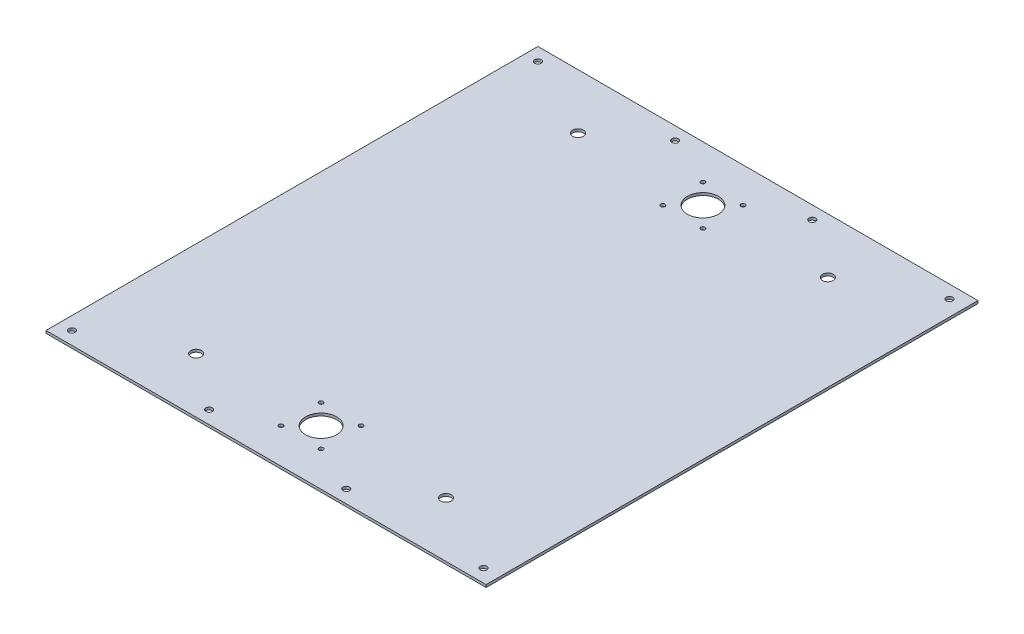
from build123d import *

# Parameters (mm, degrees)
SKICA1_W                 = 340
SKICA1_H                 = 380
SKICA1_R                 = 2.5
P_IDAT_VYSUNUT_M1_DEPTH  = 2
SKICA2_R                 = 1.650000196
SKICA2_R_2               = 1.649999612
SKICA2_R_3               = 4.150000099
SKICA2_R_4               = 4.149999924
SKICA2_R_5               = 4.149999975
SKICA2_R_6               = 4.150000026
SKICA2_R_7               = 12
ODEBRAT_VYSUNUT_M1_DEPTH = 2


with BuildPart() as part:
    # Skica1 → Přidat vysunutím1 (new body)
    with BuildSketch(Plane(origin=(0, 0, 0), x_dir=(1, 0, 0), z_dir=(0, 1, 0))):
        Rectangle(SKICA1_W, SKICA1_H)
        with Locations(Location((-160, 180, 0), (0, 0, 270))):
            Circle(SKICA1_R, mode=Mode.SUBTRACT)
        with Locations(Location((-54, 180, 0), (0, 0, 270))):
            Circle(SKICA1_R, mode=Mode.SUBTRACT)
        with Locations(Location((52, 180, 0), (0, 0, 270))):
            Circle(SKICA1_R, mode=Mode.SUBTRACT)
        with Locations(Location((158, 180, 0), (0, 0, 270))):
            Circle(SKICA1_R, mode=Mode.SUBTRACT)
        with Locations(Location((-54, -180, 0), (0, 0, 270))):
            Circle(SKICA1_R, mode=Mode.SUBTRACT)
        with Locations(Location((52, -180, 0), (0, 0, 270))):
            Circle(SKICA1_R, mode=Mode.SUBTRACT)
        with Locations(Location((158, -180, 0), (0, 0, 270))):
            Circle(SKICA1_R, mode=Mode.SUBTRACT)
        with Locations(Location((-160, -180, 0), (0, 0, 270))):
            Circle(SKICA1_R, mode=Mode.SUBTRACT)
    extrude(amount=P_IDAT_VYSUNUT_M1_DEPTH)

    # Skica2 → Odebrat vysunutím1 (cut)
    with BuildSketch(Plane.XZ):
        with Locations(Location((15.500000611, 162.999999867, 0), (0, 0, 270))):
            Circle(SKICA2_R)
        with Locations(Location((-15.499999389, 162.999999867, 0), (0, 0, 270))):
            Circle(SKICA2_R)
        with Locations(Location((-15.499999389, 131.999999867, 0), (0, 0, 270))):
            Circle(SKICA2_R)
        with Locations(Location((15.500000611, 131.999999867, 0), (0, 0, 270))):
            Circle(SKICA2_R)
        with Locations(Location((15.499999439, -162.999999266, 0), (0, 0, 270))):
            Circle(SKICA2_R_2)
        with Locations(Location((-15.500000561, -162.999999266, 0), (0, 0, 270))):
            Circle(SKICA2_R_2)
        with Locations(Location((-15.500000561, -131.999999266, 0), (0, 0, 270))):
            Circle(SKICA2_R_2)
        with Locations(Location((15.499999439, -131.999999266, 0), (0, 0, 270))):
            Circle(SKICA2_R_2)
        with Locations(Location((96.499999368, -147.499999005, 0), (0, 0, 270))):
            Circle(SKICA2_R_3)
        with Locations(Location((-96.499999659, -147.499999158, 0), (0, 0, 270))):
            Circle(SKICA2_R_4)
        with Locations(Location((-96.500017816, 147.499999068, 0), (0, 0, 270))):
            Circle(SKICA2_R_5)
        with Locations(Location((96.499999563, 147.499999035, 0), (0, 0, 270))):
            Circle(SKICA2_R_6)
        with Locations(Location((0, -147.499999158, 0), (0, 0, 270))):
            Circle(SKICA2_R_7)
        with Locations(Location((0, 147.499999035, 0), (0, 0, 270))):
            Circle(SKICA2_R_7)
    extrude(amount=-ODEBRAT_VYSUNUT_M1_DEPTH, mode=Mode.SUBTRACT)


solid = part.part
